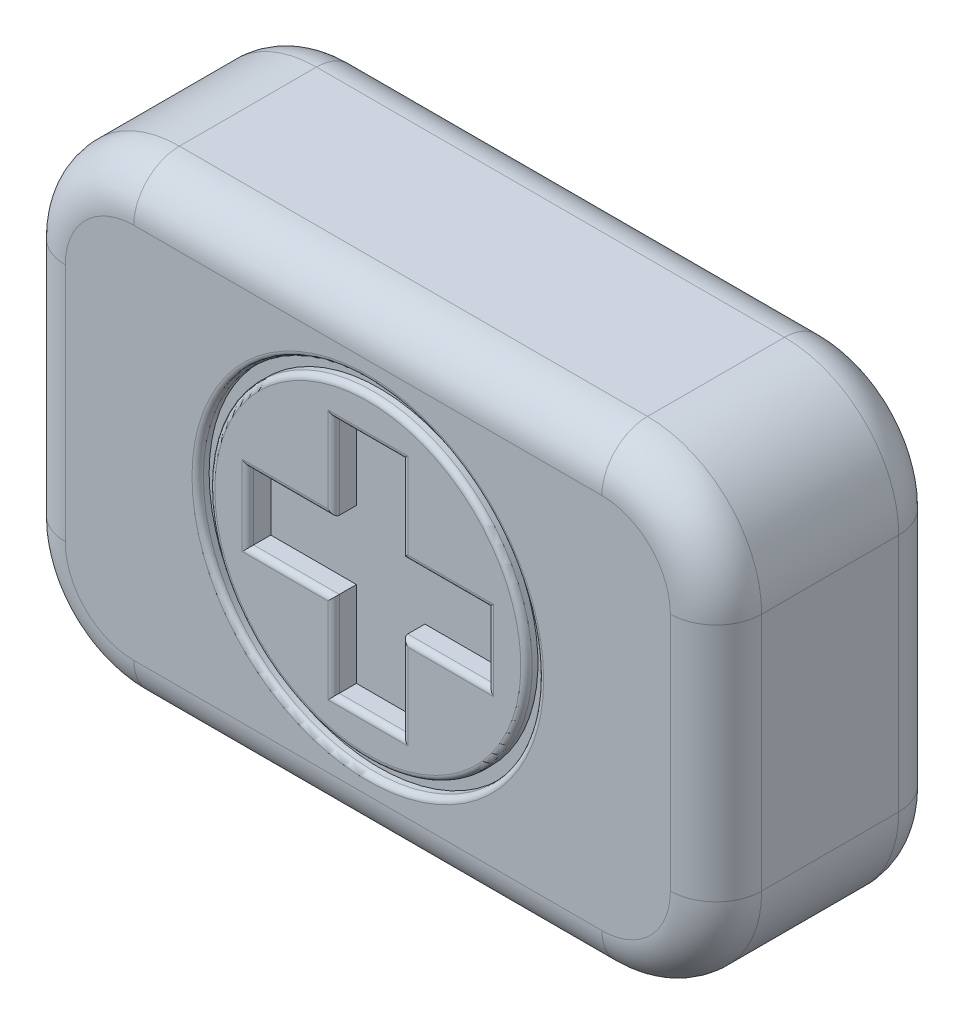
from build123d import *

# Parameters (mm, degrees)
SKETCH1_W               = 305
SKETCH1_H               = 205
BOSS_EXTRUDE1_DEPTH     = 100
FILLET1_R               = 50
FILLET2_R               = 20
SKETCH2_W               = 30
SKETCH2_H               = 105
SKETCH2_W_2             = 105
SKETCH2_H_2             = 30
CUT_EXTRUDE_THIN1_DEPTH = 10
CUT_EXTRUDE_THIN2_START = 100
SKETCH2_3_W             = 30
SKETCH2_3_H             = 105
SKETCH2_3_W_2           = 105
SKETCH2_3_H_2           = 30
CUT_EXTRUDE_THIN2_DEPTH = 10
SKETCH2_4_R             = 74.5
SKETCH2_4_R_2           = 69.5
SKETCH2_4_W             = 5
SKETCH2_4_H             = 105
SKETCH2_4_W_2           = 105
SKETCH2_4_H_2           = 5
CUT_EXTRUDE_THIN3_DEPTH = 5
CUT_EXTRUDE_THIN4_START = 95
SKETCH2_5_R             = 74.5
SKETCH2_5_R_2           = 69.5
SKETCH2_5_W             = 5
SKETCH2_5_H             = 105
SKETCH2_5_W_2           = 105
SKETCH2_5_H_2           = 5
CUT_EXTRUDE_THIN4_DEPTH = 5
FILLET3_R               = 2.5


with BuildPart() as part:
    # Sketch1 → Boss-Extrude1 (new body)
    with BuildSketch(Plane.XY):
        Rectangle(SKETCH1_W, SKETCH1_H)
    extrude(amount=BOSS_EXTRUDE1_DEPTH)

    # Fillet1
    fillet1_edges = [part.edges().sort_by_distance(p)[0] for p in [
        (-152.5, 102.5, 50),
        (152.5, 102.5, 50),
        (152.5, -102.5, 50),
        (-152.5, -102.5, 50),
    ]]
    fillet(fillet1_edges, radius=FILLET1_R)

    # Fillet2
    fillet2_edges = [part.edges().sort_by_distance(p)[0] for p in [
        (152.5, 0, 0),
        (152.5, 0, 100),
        (-152.5, 0, 0),
        (0, 102.5, 0),
        (0, -102.5, 0),
        (137.855339059, 87.855339059, 0),
        (-137.855339059, 87.855339059, 0),
        (-137.855339059, -87.855339059, 0),
        (137.855339059, -87.855339059, 0),
        (0, -102.5, 100),
        (-152.5, 0, 100),
        (0, 102.5, 100),
        (137.855339059, 87.855339059, 100),
        (-137.855339059, 87.855339059, 100),
        (-137.855339059, -87.855339059, 100),
        (137.855339059, -87.855339059, 100),
    ]]
    fillet(fillet2_edges, radius=FILLET2_R)

    # Sketch2 → Cut-Extrude-Thin1 (cut)
    with BuildSketch(Plane.XY):
        Rectangle(SKETCH2_W, SKETCH2_H)
        Rectangle(SKETCH2_W_2, SKETCH2_H_2)
    extrude(amount=CUT_EXTRUDE_THIN1_DEPTH, mode=Mode.SUBTRACT)

    # Sketch2<3> → Cut-Extrude-Thin2 (cut)
    with BuildSketch(Plane.XY.offset(CUT_EXTRUDE_THIN2_START)):
        Rectangle(SKETCH2_3_W, SKETCH2_3_H)
        Rectangle(SKETCH2_3_W_2, SKETCH2_3_H_2)
    extrude(amount=-CUT_EXTRUDE_THIN2_DEPTH, mode=Mode.SUBTRACT)

    # Sketch2<4> → Cut-Extrude-Thin3 (cut)
    # profile 1 of 3: a face of its own
    with BuildSketch(Plane.XY):
        Circle(SKETCH2_4_R)
        Circle(SKETCH2_4_R_2, mode=Mode.SUBTRACT)
    # profile 2 of 3: a face of its own
    with BuildSketch(Plane.XY):
        Rectangle(SKETCH2_4_W, SKETCH2_4_H)
    # profile 3 of 3: a face of its own
    with BuildSketch(Plane.XY):
        Rectangle(SKETCH2_4_W_2, SKETCH2_4_H_2)
    extrude(amount=CUT_EXTRUDE_THIN3_DEPTH, mode=Mode.SUBTRACT)

    # Sketch2<5> → Cut-Extrude-Thin4 (cut)
    # profile 1 of 3: a face of its own
    with BuildSketch(Plane.XY.offset(CUT_EXTRUDE_THIN4_START)):
        Circle(SKETCH2_5_R)
        Circle(SKETCH2_5_R_2, mode=Mode.SUBTRACT)
    # profile 2 of 3: a face of its own
    with BuildSketch(Plane.XY.offset(CUT_EXTRUDE_THIN4_START)):
        Rectangle(SKETCH2_5_W, SKETCH2_5_H)
    # profile 3 of 3: a face of its own
    with BuildSketch(Plane.XY.offset(CUT_EXTRUDE_THIN4_START)):
        Rectangle(SKETCH2_5_W_2, SKETCH2_5_H_2)
    extrude(amount=CUT_EXTRUDE_THIN4_DEPTH, mode=Mode.SUBTRACT)

    # Fillet3
    fillet3_edges = [part.edges().sort_by_distance(p)[0] for p in [
        (-15, 33.75, 0),
        (15, 33.75, 0),
        (33.75, 15, 0),
        (52.5, 0, 0),
        (15, -33.75, 0),
        (0, -52.5, 0),
        (-52.5, 0, 0),
        (-33.75, 15, 0),
        (0, 52.5, 0),
        (-15, -33.75, 0),
        (33.75, -15, 0),
        (-33.75, -15, 0),
        (0, -52.5, 100),
        (15, -33.75, 100),
        (33.75, -15, 100),
        (-15, 33.75, 100),
        (-33.75, -15, 100),
        (-15, -33.75, 100),
        (0, 52.5, 100),
        (15, 33.75, 100),
        (-52.5, 0, 100),
        (-33.75, 15, 100),
        (52.5, 0, 100),
        (33.75, 15, 100),
        (-69.5, 0, 0),
        (-74.5, 0, 0),
        (-69.5, 0, 100),
        (-74.5, 0, 100),
    ]]
    fillet(fillet3_edges, radius=FILLET3_R)


solid = part.part
